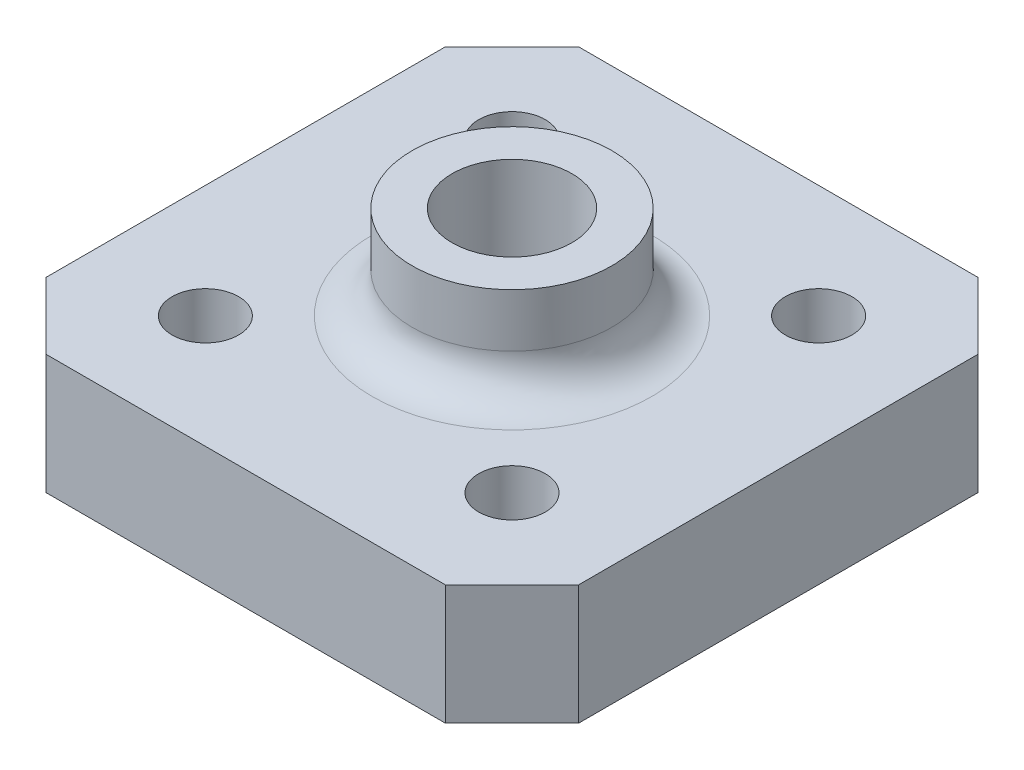
from build123d import *

# Parameters (mm, degrees)
SKETCH1_W           = 40
SKETCH1_H           = 40
BOSS_EXTRUDE1_DEPTH = 6
SKETCH2_W           = 40
SKETCH2_H           = 40
SKETCH2_R           = 4.5
BOSS_EXTRUDE2_DEPTH = 3
SKETCH3_R           = 2.5
CUT_EXTRUDE1_DEPTH  = 24
SKETCH4_R           = 7.5
SKETCH4_R_2         = 4.5
BOSS_EXTRUDE3_DEPTH = 7
FILLET1_R           = 3
CHAMFER1_SIZE       = 5


with BuildPart() as part:
    # Sketch1 → Boss-Extrude1 (new body)
    with BuildSketch(Plane(origin=(0, 0, 0), x_dir=(1, 0, 0), z_dir=(0, 1, 0))):
        Rectangle(SKETCH1_W, SKETCH1_H)
        Polygon((7.505553499, 0), (3.75277675, 6.5), (-3.75277675, 6.5), (-7.505553499, 0), (-3.75277675, -6.5), (3.75277675, -6.5), align=None, mode=Mode.SUBTRACT)
    extrude(amount=BOSS_EXTRUDE1_DEPTH)

    # Sketch2 → Boss-Extrude2 (add)
    with BuildSketch(Plane(origin=(0, 6, 0), x_dir=(1, 0, 0), z_dir=(0, 1, 0))):
        Rectangle(SKETCH2_W, SKETCH2_H)
        with Locations(Location((0, 0, 0), (0, 0, 270))):
            Circle(SKETCH2_R, mode=Mode.SUBTRACT)
    extrude(amount=BOSS_EXTRUDE2_DEPTH)

    # Sketch3 → Cut-Extrude1 (cut)
    with BuildSketch(Plane(origin=(0, 9, 0), x_dir=(1, 0, 0), z_dir=(0, 1, 0))):
        with Locations(Location((-11.514718626, 11.514718626, 0), (0, 0, 270))):
            Circle(SKETCH3_R)
        with Locations(Location((11.514718626, 11.514718626, 0), (0, 0, 270))):
            Circle(SKETCH3_R)
        with Locations(Location((11.514718626, -11.514718626, 0), (0, 0, 270))):
            Circle(SKETCH3_R)
        with Locations(Location((-11.514718626, -11.514718626, 0), (0, 0, 270))):
            Circle(SKETCH3_R)
    extrude(amount=-CUT_EXTRUDE1_DEPTH, mode=Mode.SUBTRACT)

    # Sketch4 → Boss-Extrude3 (add)
    with BuildSketch(Plane(origin=(0, 9, 0), x_dir=(1, 0, 0), z_dir=(0, 1, 0))):
        with Locations(Location((0, 0, 0), (0, 0, 90))):
            Circle(SKETCH4_R)
        with Locations(Location((0, 0, 0), (0, 0, 270))):
            Circle(SKETCH4_R_2, mode=Mode.SUBTRACT)
    extrude(amount=BOSS_EXTRUDE3_DEPTH)

    # Fillet1
    fillet1_edges = [part.edges().sort_by_distance(p)[0] for p in [
        (0, 9, 7.5),
    ]]
    fillet(fillet1_edges, radius=FILLET1_R)

    # Chamfer1
    chamfer1_edges = [part.edges().sort_by_distance(p)[0] for p in [
        (20, 4.5, 20),
        (-20, 4.5, 20),
        (-20, 4.5, -20),
        (20, 4.5, -20),
    ]]
    chamfer(chamfer1_edges, length=CHAMFER1_SIZE)


solid = part.part
